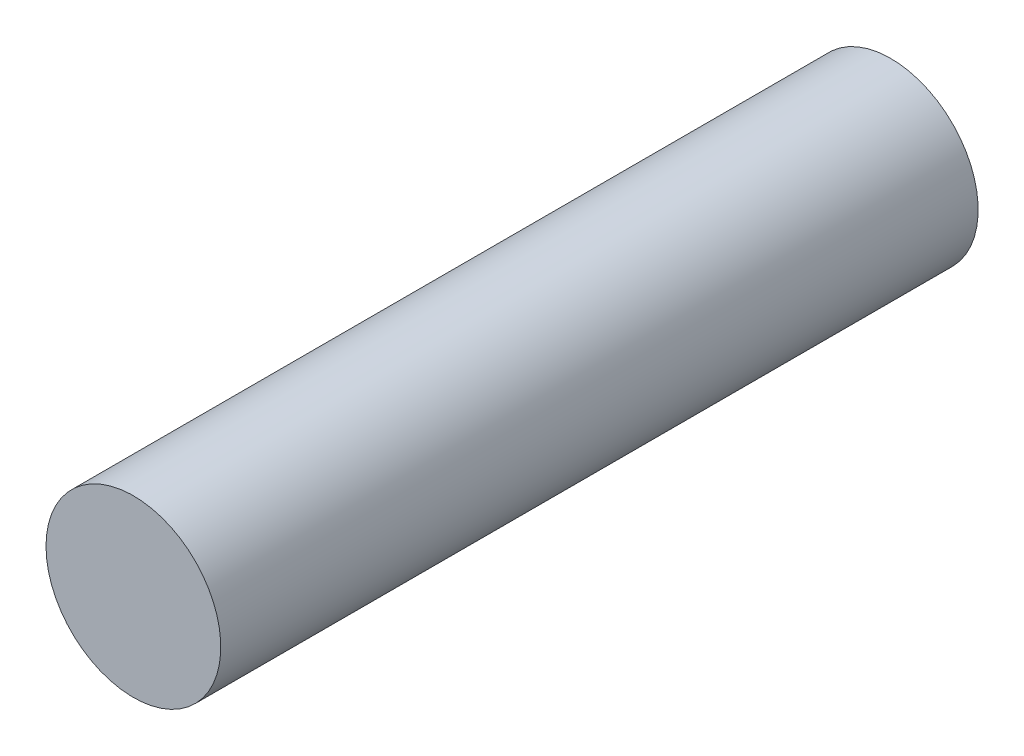
from build123d import *

# Parameters (mm, degrees)
SKETCH1_R           = 19.05
BOSS_EXTRUDE1_DEPTH = 165.1


with BuildPart() as part:
    # Sketch1 → Boss-Extrude1 (new body)
    with BuildSketch(Plane.XY):
        with Locations(Location((0, 0, 0), (0, 0, 180))):
            Circle(SKETCH1_R)
    extrude(amount=BOSS_EXTRUDE1_DEPTH)


solid = part.part
